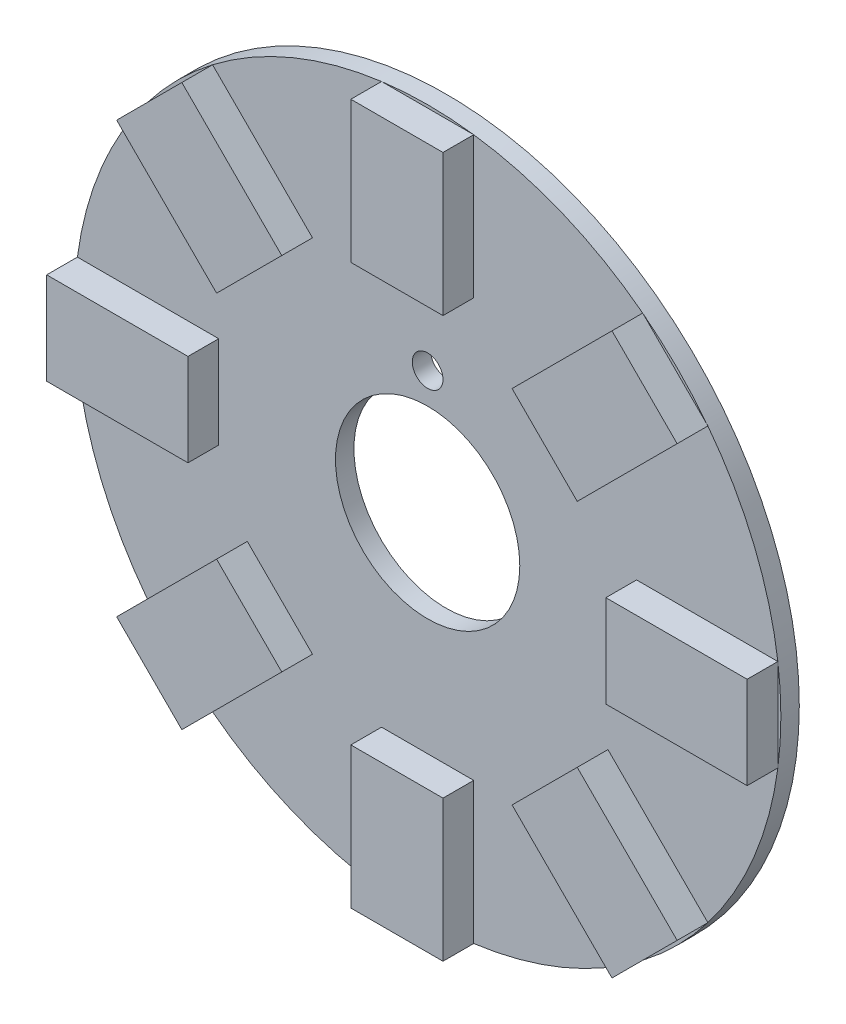
from build123d import *

# Parameters (mm, degrees)
SCHIZZO1_R                  = 115
ESTRUSIONE1_DEPTH           = 6
SCHIZZO2_W                  = 30
SCHIZZO2_H                  = 46
ESTRUSIONE2_DEPTH           = 10
RIPETIZIONECIRCOLARE1_COUNT = 8
SCHIZZO4_R                  = 30
ESTRUSIONE3_DEPTH           = 163.941707368
SCHIZZO5_R                  = 5
ESTRUSIONE4_DEPTH           = 163.941707368


with BuildPart() as part:
    # Schizzo1 → Estrusione1 (new body)
    with BuildSketch(Plane.XY):
        Circle(SCHIZZO1_R)
    extrude(amount=ESTRUSIONE1_DEPTH)

    # Schizzo2 → Estrusione2 (add)
    with BuildSketch(Plane.XY.offset(6)):
        with Locations((0, 91.01754251)):
            Rectangle(SCHIZZO2_W, SCHIZZO2_H)
    estrusione2 = extrude(amount=ESTRUSIONE2_DEPTH)

    # RipetizioneCircolare1: Estrusione2 ×8 about axis
    ripetizionecircolare1_axis = Axis((0, 0, 6), (0, 0, -1))
    for i in range(1, RIPETIZIONECIRCOLARE1_COUNT):
        add(estrusione2.rotate(ripetizionecircolare1_axis, i * 360 / RIPETIZIONECIRCOLARE1_COUNT))

    # Schizzo4 → Estrusione3 (cut, through all)
    with BuildSketch(Plane.XY.offset(6)):
        Circle(SCHIZZO4_R)
    extrude(amount=-ESTRUSIONE3_DEPTH, mode=Mode.SUBTRACT)

    # Schizzo5 → Estrusione4 (cut, through all)
    with BuildSketch(Plane.XY.offset(6)):
        with Locations((0, 40)):
            Circle(SCHIZZO5_R)
    extrude(amount=-ESTRUSIONE4_DEPTH, mode=Mode.SUBTRACT)


solid = part.part
